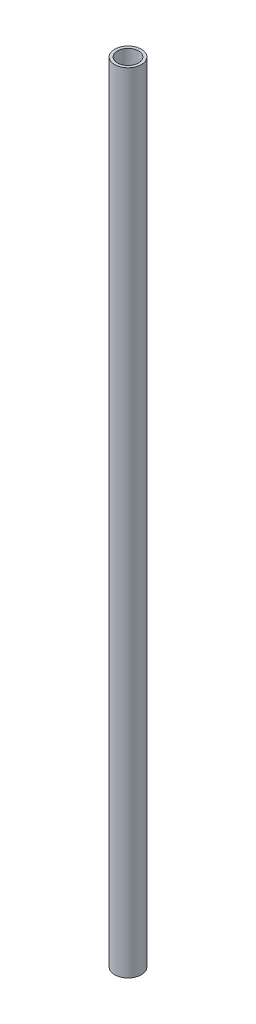
from build123d import *

# Parameters (mm, degrees)
SKETCH1_R           = 12.7
SKETCH1_R_2         = 10
BOSS_EXTRUDE1_DEPTH = 750


with BuildPart() as part:
    # Sketch1 → Boss-Extrude1 (new body)
    with BuildSketch(Plane(origin=(0, 0, 0), x_dir=(1, 0, 0), z_dir=(0, 1, 0))):
        with Locations(Location((0, 0, 0), (0, 0, 270))):
            Circle(SKETCH1_R)
        with Locations(Location((0, 0, 0), (0, 0, 270))):
            Circle(SKETCH1_R_2, mode=Mode.SUBTRACT)
    extrude(amount=BOSS_EXTRUDE1_DEPTH)


solid = part.part
